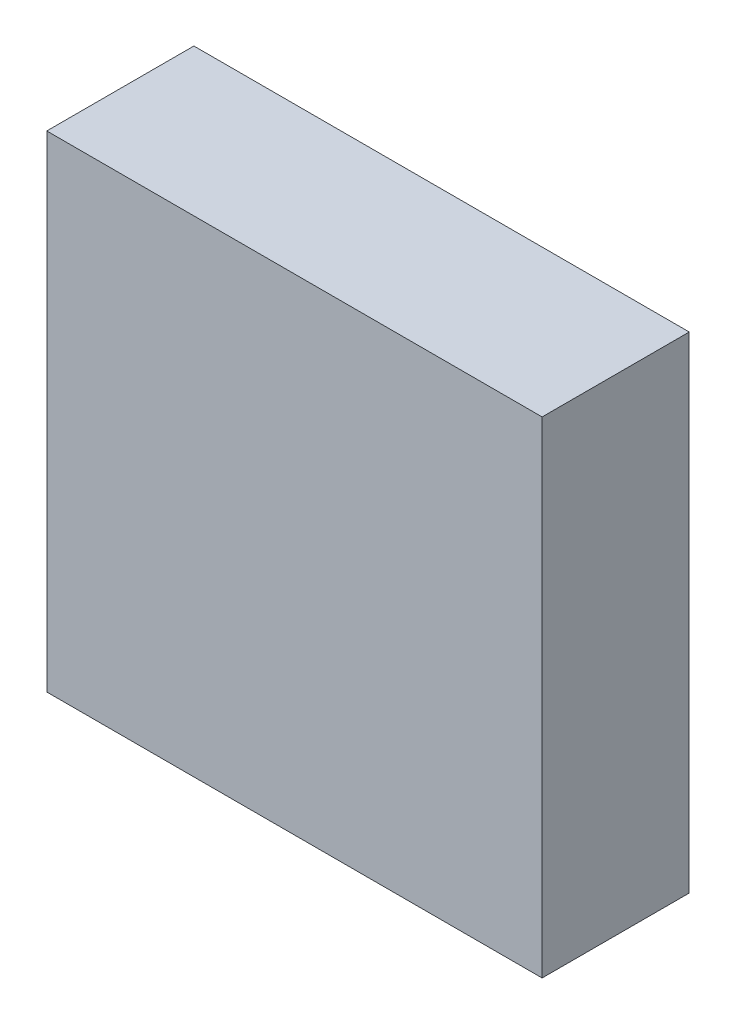
from build123d import *

# Parameters (mm, degrees)
SKETCH1_W           = 36.7
SKETCH1_H           = 36
BOSS_EXTRUDE1_DEPTH = 10.9


with BuildPart() as part:
    # Sketch1 → Boss-Extrude1 (new body)
    with BuildSketch(Plane.XY):
        with Locations((18.35, 18)):
            Rectangle(SKETCH1_W, SKETCH1_H)
    extrude(amount=BOSS_EXTRUDE1_DEPTH)


solid = part.part
